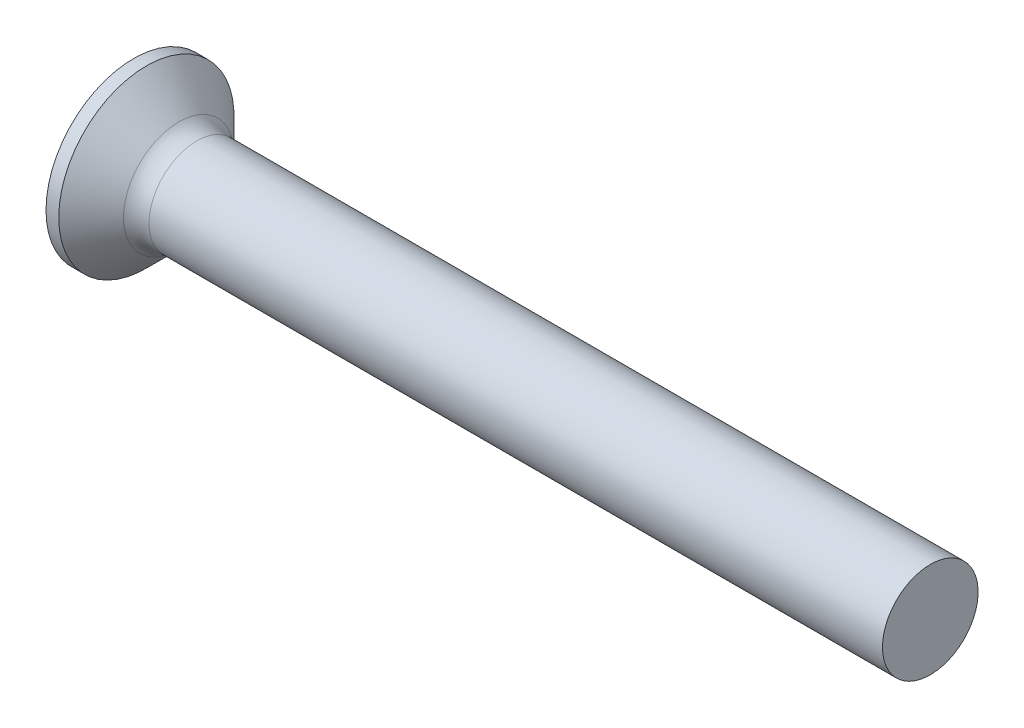
from build123d import *

# Parameters (mm, degrees)
FILLET1_R    = 0.8
RECPAT_COUNT = 2
RECPAT_ANGLE = 90


with BuildPart() as part:
    # BodySke → Base-Revolve (revolve)
    with BuildSketch(Plane.XY, mode=Mode.PRIVATE) as base_revolve_sk:
        with BuildLine():
            Line((0, 0), (25.7, 0))
            Line((25.7, 0), (25.7, 1.5))
            Line((25.7, 1.5), (2.35, 1.5))
            Line((2.35, 1.5), (1.1, 2.75))
            Line((1.1, 2.75), (0.7, 2.75))
            ThreePointArc((0.7, 2.75), (0.177746434, 1.418846362), (0, 0))
        make_face()
    revolve(base_revolve_sk.sketch.rotate(Axis((-15.875, 0, 0), (1, 0, 0)), 90), axis=Axis((-15.875, 0, 0), (1, 0, 0)))

    # Fillet1
    fillet1_edges = [part.edges().sort_by_distance(p)[0] for p in [
        (2.35, 0, -1.5),
    ]]
    fillet(fillet1_edges, radius=FILLET1_R)

    # Sketch3 → Recess section 0
    with BuildSketch(Plane(origin=(0, 0, 0), x_dir=(0, 0, -1), z_dir=(1, 0, 0))):
        with BuildLine():
            Line((0.37, -1.55), (-0.37, -1.55))
            Line((-0.37, -1.55), (-0.37, 1.55))
            Line((-0.37, 1.55), (0.37, 1.55))
            Line((0.37, 1.55), (0.37, -1.55))
        make_face()
    # Sketch4 → Recess section 1
    with BuildSketch(Plane(origin=(2.08, 0, 0), x_dir=(0, 0, -1), z_dir=(1, 0, 0))):
        with BuildLine():
            Line((0.37, -0.512950429), (-0.37, -0.512950429))
            Line((-0.37, -0.512950429), (-0.37, 0.512950429))
            Line((-0.37, 0.512950429), (0.37, 0.512950429))
            Line((0.37, 0.512950429), (0.37, -0.512950429))
        make_face()
    recess = loft(mode=Mode.SUBTRACT)

    # RecPat: Recess ×2 about axis
    recpat_axis = Axis((0, 0, 0), (1, 0, 0))
    for i in range(1, RECPAT_COUNT):
        add(recess.rotate(recpat_axis, i * RECPAT_ANGLE / (RECPAT_COUNT - 1)), mode=Mode.SUBTRACT)

    # RecCorSke → RecessCore (revolve, cut)
    with BuildSketch(Plane.XY, mode=Mode.PRIVATE) as recesscore_sk:
        Polygon((0, 0), (0, 0.701447769), (2.08, 0.556), (2.260655351, 0), align=None)
    revolve(recesscore_sk.sketch.rotate(Axis((-3.175, 0, 0), (1, 0, 0)), 90), axis=Axis((-3.175, 0, 0), (1, 0, 0)), mode=Mode.SUBTRACT)


solid = part.part
